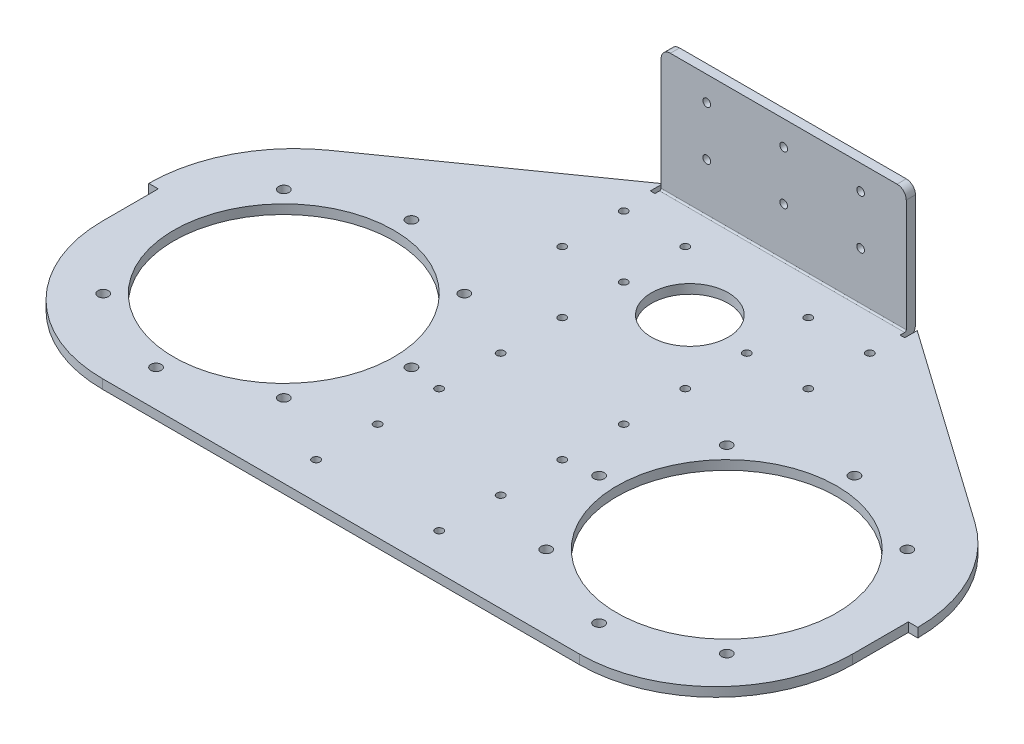
from build123d import *

# Parameters (mm, degrees)
EXTRUDE_1_DEPTH             = 3
SKETCH_2_W                  = 243.8
SKETCH_2_H                  = 3
EXTRUDE_2_DEPTH             = 62.5
SKETCH_3_W                  = 79.68324927
SKETCH_3_H                  = 3
EXTRUDE_3_DEPTH             = 5
SKETCH_4_W                  = 79.68324927
SKETCH_4_H                  = 3
EXTRUDE_4_DEPTH             = 40
HOLE_WIZARD_2_5_2_5_1_D     = 2.5
HOLE_WIZARD_25_0_25_1_D     = 25
HOLE_WIZARD_25_0_25_1_DEPTH = 43
HOLE_WIZARD_M641_D          = 71.5
HOLE_WIZARD_M641_DEPTH      = 43
HOLE_WIZARD_3_4_3_4_1_D     = 3.4
HOLE_WIZARD_3_4_3_4_1_DEPTH = 43
HOLE_WIZARD_2_5_2_5_2_D     = 2.5
HOLE_WIZARD_2_5_2_5_2_DEPTH = 43
FILLET_1_R                  = 0.5
FILLET_2_R                  = 3
FILLET_3_R                  = 3.5
FILLET_4_R                  = 44.4


with BuildPart() as part:
    # Эскиз1 → Бобышка-Вытянуть1 (new body)
    with BuildSketch(Plane.XZ.offset(-247)):
        with BuildLine():
            Line((124.999894737, -9.1), (-124.999894737, -9.1))
            ThreePointArc((-124.999894737, -9.1), (-119.638879455, -30.921789121), (-104.847515108, -47.837654634))
            Line((-104.847515108, -47.837654634), (-41.341624635, -92.555295683))
            Line((-41.341624635, -92.555295683), (-41.341624635, -88.5))
            Line((-41.341624635, -88.5), (41.341624635, -88.5))
            Line((41.341624635, -88.5), (41.341624635, -92.555295631))
            Line((41.341624635, -92.555295631), (104.847515108, -47.837654582))
            ThreePointArc((104.847515108, -47.837654582), (119.638879443, -30.921789092), (124.999894737, -9.1))
        make_face()
    extrude(amount=-EXTRUDE_1_DEPTH)

    # Эскиз2 → Бобышка-Вытянуть2 (add)
    with BuildSketch(Plane.XY.offset(-9.1)):
        with Locations((2e-09, 248.5)):
            Rectangle(SKETCH_2_W, SKETCH_2_H)
    extrude(amount=EXTRUDE_2_DEPTH)

    # Эскиз3 → Бобышка-Вытянуть3 (add)
    with BuildSketch(Plane(origin=(0, 0, -88.5), x_dir=(-1, 0, 0), z_dir=(0, 0, -1))):
        with Locations((0, 248.5)):
            Rectangle(SKETCH_3_W, SKETCH_3_H)
    extrude(amount=EXTRUDE_3_DEPTH)

    # Эскиз4 → Бобышка-Вытянуть4 (add)
    with BuildSketch(Plane(origin=(0, 250, 0), x_dir=(-1, 0, 0), z_dir=(0, 1, 0))):
        with Locations((0, -92)):
            Rectangle(SKETCH_4_W, SKETCH_4_H)
    extrude(amount=EXTRUDE_4_DEPTH)

    # Диаметр отверстия Ø2.5 (2.5)1 (through all)
    with Locations(Plane.XY.offset(-90.5)):
        with Locations((25, 266), (25, 282), (0, 266), (0, 282), (-25, 266), (-25, 282)):
            Hole(HOLE_WIZARD_2_5_2_5_1_D / 2)

    # Диаметр отверстия Ø25.0 (25)1
    with Locations(Plane(origin=(0, 247, 0), x_dir=(-1, 0, 0), z_dir=(0, -1, 0))):
        with Locations((0, 60)):
            Hole(HOLE_WIZARD_25_0_25_1_D / 2, depth=HOLE_WIZARD_25_0_25_1_DEPTH)

    # Отверстие с зазором M641
    with Locations(Plane(origin=(0, 247, 0), x_dir=(-1, 0, 0), z_dir=(0, -1, 0))):
        with Locations((72, 0), (-72, 0)):
            Hole(HOLE_WIZARD_M641_D / 2, depth=HOLE_WIZARD_M641_DEPTH)

    # Диаметр отверстия Ø3.4 (3.4)1
    with Locations(Plane(origin=(0, 247, 0), x_dir=(-1, 0, 0), z_dir=(0, -1, 0))):
        with Locations((72, 41.5), (42.655068581, 29.344931419), (30.5, 0), (42.655068581, -29.344931419), (72, -41.5), (101.344931419, -29.344931419), (101.344931419, 29.344931419), (-101.344931419, 29.344931419), (-101.344931419, -29.344931419), (-72, -41.5), (-42.655068581, -29.344931419), (-30.5, 0), (-42.655068581, 29.344931419), (-72, 41.5)):
            Hole(HOLE_WIZARD_3_4_3_4_1_D / 2, depth=HOLE_WIZARD_3_4_3_4_1_DEPTH)

    # Диаметр отверстия Ø2.5 (2.5)2
    with Locations(Plane(origin=(0, 247, 0), x_dir=(-1, 0, 0), z_dir=(0, -1, 0))):
        with Locations((-20, 58.5), (20, 18.5), (-20, 18.5), (-20, -1.5), (20, -21.5), (20, -41.5), (-20, -41.5), (-20, -21.5), (20, -1.5), (-20, 38.5), (20, 38.5), (-40, 58.5), (-40, 78.5), (-20, 78.5), (20, 58.5), (20, 78.5), (40, 58.5), (40, 78.5)):
            Hole(HOLE_WIZARD_2_5_2_5_2_D / 2, depth=HOLE_WIZARD_2_5_2_5_2_DEPTH)

    # Скругление1
    fillet_1_edges = [part.edges().sort_by_distance(p)[0] for p in [
        (0, 250, -90.5),
    ]]
    fillet(fillet_1_edges, radius=FILLET_1_R)

    # Скругление2
    fillet_2_edges = [part.edges().sort_by_distance(p)[0] for p in [
        (-39.841624635, 290, -92),
        (39.841624635, 290, -92),
    ]]
    fillet(fillet_2_edges, radius=FILLET_2_R)

    # Скругление3
    fillet_3_edges = [part.edges().sort_by_distance(p)[0] for p in [
        (0, 247, -93.5),
    ]]
    fillet(fillet_3_edges, radius=FILLET_3_R)

    # Скругление4
    fillet_4_edges = [part.edges().sort_by_distance(p)[0] for p in [
        (121.900000002, 248.5, 53.4),
        (-121.899999998, 248.5, 53.4),
    ]]
    fillet(fillet_4_edges, radius=FILLET_4_R)


solid = part.part
